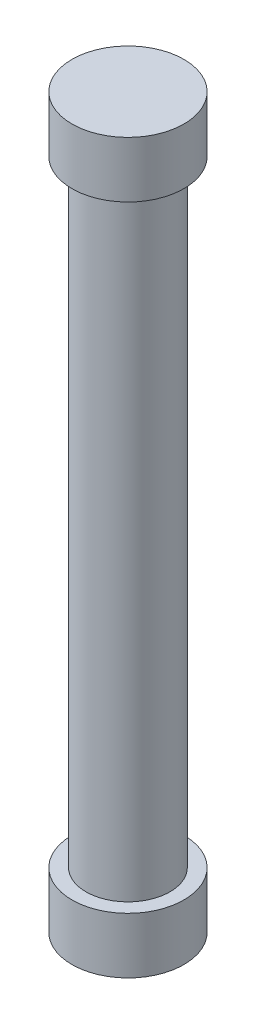
from build123d import *


with BuildPart() as part:
    # Sketch1 → Revolve1 (revolve)
    with BuildSketch(Plane.XY):
        Polygon((0, 20.95644578), (0, -5.04355422), (-2, -5.04355422), (-2, -3.04355422), (-1.5, -3.04355422), (-1.5, 18.95644578), (-2, 18.95644578), (-2, 20.95644578), align=None)
    revolve(axis=Axis((0, 20.95644578, 0), (0, -1, 0)))


solid = part.part
